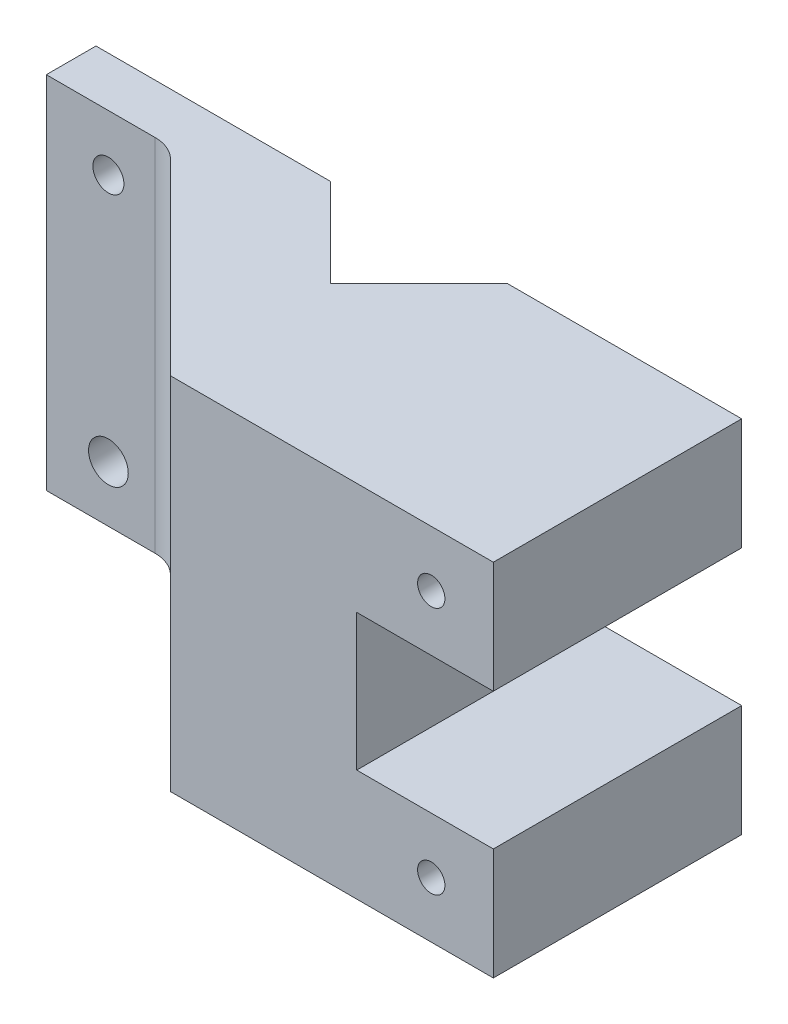
from build123d import *

# Parameters (mm, degrees)
BOSS_EXTRUDE1_DEPTH     = 14.5
CUT_EXTRUDE2_DEPTH      = 36.864327681
CUT_EXTRUDE2_DEPTH_BACK = 36.864327681
SKETCH4_R               = 1.1
SKETCH4_W               = 11
SKETCH4_H               = 11
SKETCH5_R               = 1.25
SKETCH5_R_2             = 1.6
CUT_EXTRUDE3_DEPTH      = 34.797189232
FILLET1_R               = 3


with BuildPart() as part:
    # Sketch1 → Boss-Extrude1 (new, symmetric)
    with BuildSketch(Plane(origin=(0, 0, 0), x_dir=(1, 0, 0), z_dir=(0, 1, 0))):
        Polygon((-7.131727984, 0), (-26, 0), (-26, -4), (-16, -4), (0, -20), (26, -20), (26, 0), (7.131727984, 0), (0, -7.131727984), align=None)
    extrude(amount=BOSS_EXTRUDE1_DEPTH, both=True)

    # Sketch4 → Cut-Extrude2 (cut, two sides: drawn at the far end of the back side and taken through both)
    with BuildSketch(Plane.XY.offset(20).offset(-CUT_EXTRUDE2_DEPTH_BACK)):
        with Locations((21, 10)):
            Circle(SKETCH4_R)
        with Locations((21, -10)):
            Circle(SKETCH4_R)
        with Locations((20.5, 0)):
            Rectangle(SKETCH4_W, SKETCH4_H)
    extrude(amount=CUT_EXTRUDE2_DEPTH + CUT_EXTRUDE2_DEPTH_BACK, mode=Mode.SUBTRACT)

    # Sketch5 → Cut-Extrude3 (cut, through all)
    with BuildSketch(Plane.XY.offset(4)):
        with Locations((-21, 10)):
            Circle(SKETCH5_R)
        with Locations((-21, -10)):
            Circle(SKETCH5_R_2)
    extrude(amount=-CUT_EXTRUDE3_DEPTH, mode=Mode.SUBTRACT)

    # Fillet1
    fillet1_edges = [part.edges().sort_by_distance(p)[0] for p in [
        (-16, 0, 4),
    ]]
    fillet(fillet1_edges, radius=FILLET1_R)


solid = part.part
